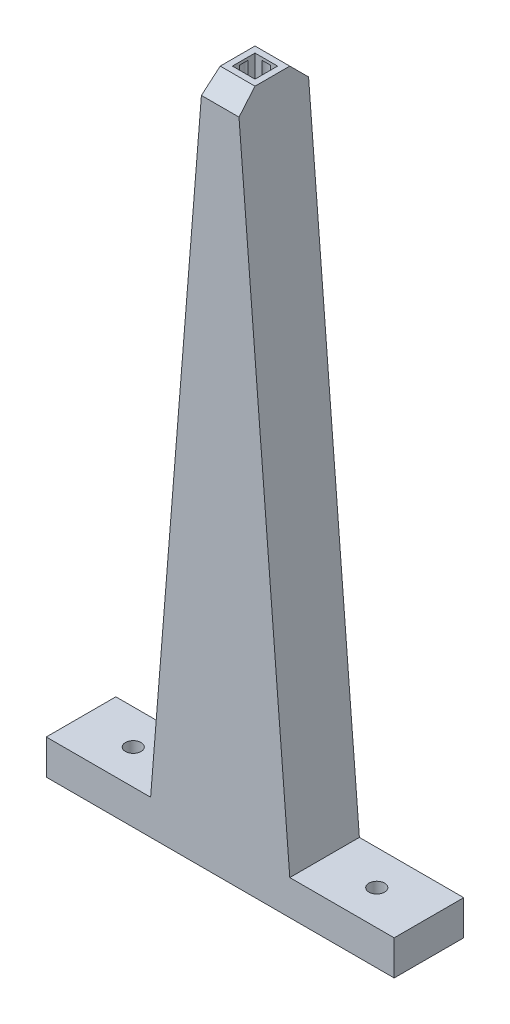
from build123d import *

# Parameters (mm, degrees)
RESSALTO_EXTRUS_O4_DEPTH = 20
ESBO_O8_W                = 6.5
ESBO_O8_H                = 6.5
CORTE_EXTRUS_O1_DEPTH    = 15
CORTE_EXTRUS_O2_START    = -1
CORTE_EXTRUS_O2_DEPTH    = 4
CHANFRO1_SIZE            = 0.2
CHANFRO2_SIZE            = 5
ESBO_O10_R               = 2.25
CORTE_EXTRUS_O3_DEPTH    = 214


with BuildPart() as part:
    # Esboço7 → Ressalto-extrusão4 (new body)
    with BuildSketch(Plane.XY):
        Polygon((0, 0), (100, 0), (100, 10), (70, 10), (55, 197), (45, 197), (30, 10), (0, 10), align=None)
    extrude(amount=RESSALTO_EXTRUS_O4_DEPTH)

    # Esboço8 → Corte-extrusão1 (cut)
    with BuildSketch(Plane(origin=(0, 197, 0), x_dir=(1, 0, 0), z_dir=(0, 1, 0))):
        with Locations((50, -10)):
            Rectangle(ESBO_O8_W, ESBO_O8_H)
    extrude(amount=-CORTE_EXTRUS_O1_DEPTH, mode=Mode.SUBTRACT)

    # Esboço9 → Corte-extrusão2 (cut)
    with BuildSketch(Plane(origin=(0, 197, 0), x_dir=(1, 0, 0), z_dir=(0, 1, 0)).offset(CORTE_EXTRUS_O2_START)):
        with BuildLine():
            Line((48.75, -6.75), (51.25, -6.75))
            ThreePointArc((51.25, -6.75), (50, -6.079156198), (48.75, -6.75))
        make_face()
        with BuildLine():
            Line((53.25, -8.75), (53.25, -11.25))
            ThreePointArc((53.25, -11.25), (53.920843802, -10), (53.25, -8.75))
        make_face()
        with BuildLine():
            Line((46.75, -8.75), (46.75, -11.25))
            ThreePointArc((46.75, -11.25), (46.079156198, -10), (46.75, -8.75))
        make_face()
        with BuildLine():
            Line((48.75, -13.25), (51.25, -13.25))
            ThreePointArc((51.25, -13.25), (50, -13.920843802), (48.75, -13.25))
        make_face()
    extrude(amount=-CORTE_EXTRUS_O2_DEPTH, mode=Mode.SUBTRACT)

    # Chanfro1
    chanfro1_edges = [part.edges().sort_by_distance(p)[0] for p in [
        (50, 196, 6.75),
        (53.25, 196, 10),
        (50, 196, 13.25),
        (46.75, 196, 10),
    ]]
    chamfer(chanfro1_edges, length=CHANFRO1_SIZE)

    # Chanfro2
    chanfro2_edges = [part.edges().sort_by_distance(p)[0] for p in [
        (50, 197, 20),
        (50, 197, 0),
    ]]
    chamfer(chanfro2_edges, length=CHANFRO2_SIZE)

    # Esboço10 → Corte-extrusão3 (cut, through all)
    with BuildSketch(Plane(origin=(0, 10, 0), x_dir=(1, 0, 0), z_dir=(0, 1, 0))):
        with Locations(Location((15, -10, 0), (0, 0, 180))):
            Circle(ESBO_O10_R)
        with Locations(Location((85, -10, 0), (0, 0, 180))):
            Circle(ESBO_O10_R)
    extrude(amount=-CORTE_EXTRUS_O3_DEPTH, mode=Mode.SUBTRACT)


solid = part.part
